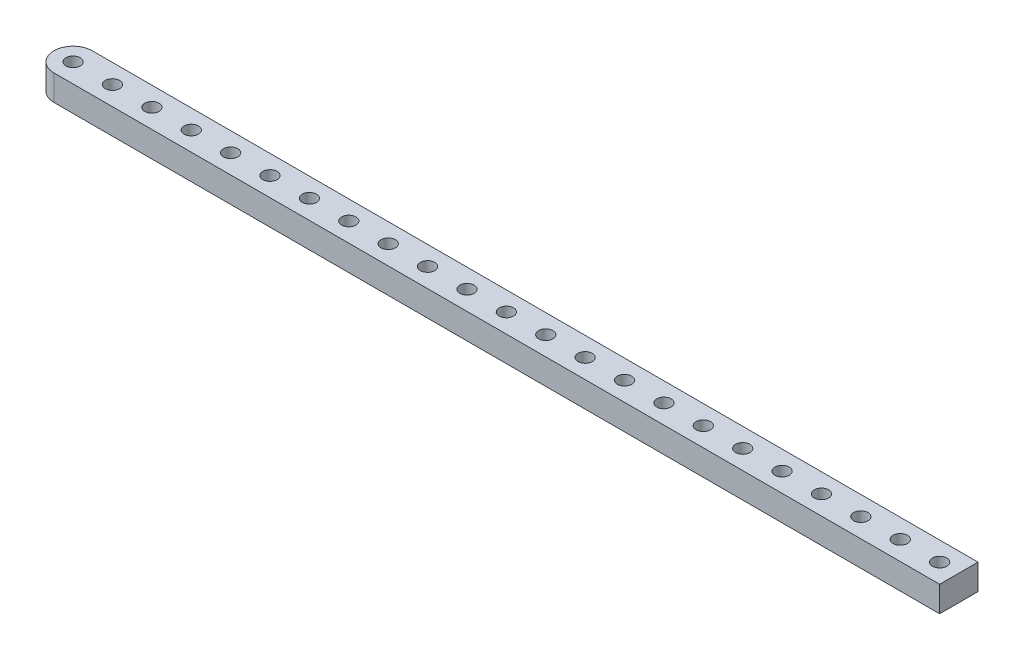
from build123d import *

# Parameters (mm, degrees)
SKETCH1_R           = 1.778
BOSS_EXTRUDE1_DEPTH = 6.35
SKETCH2_W           = 100.128840489
SKETCH2_H           = 9.525
CUT_EXTRUDE1_DEPTH  = 162.421771173


with BuildPart() as part:
    # Sketch1 → Boss-Extrude1 (new body)
    with BuildSketch(Plane(origin=(0, 6.35, 0), x_dir=(1, 0, 0), z_dir=(0, 1, 0))):
        with BuildLine():
            Line((156.464, 4.7625), (-156.464, 4.7625))
            ThreePointArc((-156.464, 4.7625), (-161.2265, 0), (-156.464, -4.7625))
            Line((-156.464, -4.7625), (156.464, -4.7625))
            ThreePointArc((156.464, -4.7625), (161.2265, 0), (156.464, 4.7625))
        make_face()
        with Locations(Location((156.464, 0, 0), (0, 0, 270))):
            Circle(SKETCH1_R, mode=Mode.SUBTRACT)
        with Locations(Location((146.685, 0, 0), (0, 0, 270))):
            Circle(SKETCH1_R, mode=Mode.SUBTRACT)
        with Locations(Location((136.906, 0, 0), (0, 0, 270))):
            Circle(SKETCH1_R, mode=Mode.SUBTRACT)
        with Locations(Location((127.127, 0, 0), (0, 0, 270))):
            Circle(SKETCH1_R, mode=Mode.SUBTRACT)
        with Locations(Location((117.348, 0, 0), (0, 0, 270))):
            Circle(SKETCH1_R, mode=Mode.SUBTRACT)
        with Locations(Location((107.569, 0, 0), (0, 0, 270))):
            Circle(SKETCH1_R, mode=Mode.SUBTRACT)
        with Locations(Location((97.79, 0, 0), (0, 0, 270))):
            Circle(SKETCH1_R, mode=Mode.SUBTRACT)
        with Locations(Location((88.011, 0, 0), (0, 0, 270))):
            Circle(SKETCH1_R, mode=Mode.SUBTRACT)
        with Locations(Location((78.232, 0, 0), (0, 0, 270))):
            Circle(SKETCH1_R, mode=Mode.SUBTRACT)
        with Locations(Location((68.453, 0, 0), (0, 0, 270))):
            Circle(SKETCH1_R, mode=Mode.SUBTRACT)
        with Locations(Location((58.674, 0, 0), (0, 0, 270))):
            Circle(SKETCH1_R, mode=Mode.SUBTRACT)
        with Locations(Location((48.895, 0, 0), (0, 0, 270))):
            Circle(SKETCH1_R, mode=Mode.SUBTRACT)
        with Locations(Location((39.116, 0, 0), (0, 0, 270))):
            Circle(SKETCH1_R, mode=Mode.SUBTRACT)
        with Locations(Location((29.337, 0, 0), (0, 0, 270))):
            Circle(SKETCH1_R, mode=Mode.SUBTRACT)
        with Locations(Location((19.558, 0, 0), (0, 0, 270))):
            Circle(SKETCH1_R, mode=Mode.SUBTRACT)
        with Locations(Location((9.779, 0, 0), (0, 0, 270))):
            Circle(SKETCH1_R, mode=Mode.SUBTRACT)
        with Locations(Location((0, 0, 0), (0, 0, 270))):
            Circle(SKETCH1_R, mode=Mode.SUBTRACT)
        with Locations(Location((-9.779, 0, 0), (0, 0, 270))):
            Circle(SKETCH1_R, mode=Mode.SUBTRACT)
        with Locations(Location((-19.558, 0, 0), (0, 0, 270))):
            Circle(SKETCH1_R, mode=Mode.SUBTRACT)
        with Locations(Location((-29.337, 0, 0), (0, 0, 270))):
            Circle(SKETCH1_R, mode=Mode.SUBTRACT)
        with Locations(Location((-39.116, 0, 0), (0, 0, 270))):
            Circle(SKETCH1_R, mode=Mode.SUBTRACT)
        with Locations(Location((-48.895, 0, 0), (0, 0, 270))):
            Circle(SKETCH1_R, mode=Mode.SUBTRACT)
        with Locations(Location((-58.674, 0, 0), (0, 0, 270))):
            Circle(SKETCH1_R, mode=Mode.SUBTRACT)
        with Locations(Location((-68.453, 0, 0), (0, 0, 270))):
            Circle(SKETCH1_R, mode=Mode.SUBTRACT)
        with Locations(Location((-78.232, 0, 0), (0, 0, 270))):
            Circle(SKETCH1_R, mode=Mode.SUBTRACT)
        with Locations(Location((-88.011, 0, 0), (0, 0, 270))):
            Circle(SKETCH1_R, mode=Mode.SUBTRACT)
        with Locations(Location((-97.79, 0, 0), (0, 0, 270))):
            Circle(SKETCH1_R, mode=Mode.SUBTRACT)
        with Locations(Location((-107.569, 0, 0), (0, 0, 270))):
            Circle(SKETCH1_R, mode=Mode.SUBTRACT)
        with Locations(Location((-117.348, 0, 0), (0, 0, 270))):
            Circle(SKETCH1_R, mode=Mode.SUBTRACT)
        with Locations(Location((-127.127, 0, 0), (0, 0, 270))):
            Circle(SKETCH1_R, mode=Mode.SUBTRACT)
        with Locations(Location((-136.906, 0, 0), (0, 0, 270))):
            Circle(SKETCH1_R, mode=Mode.SUBTRACT)
        with Locations(Location((-146.685, 0, 0), (0, 0, 270))):
            Circle(SKETCH1_R, mode=Mode.SUBTRACT)
        with Locations(Location((-156.464, 0, 0), (0, 0, 270))):
            Circle(SKETCH1_R, mode=Mode.SUBTRACT)
    extrude(amount=-BOSS_EXTRUDE1_DEPTH)

    # Sketch2 → Cut-Extrude1 (cut, through all)
    with BuildSketch(Plane(origin=(0, 6.35, 0), x_dir=(1, 0, 0), z_dir=(0, 1, 0))):
        with Locations((113.500920245, 0)):
            Rectangle(SKETCH2_W, SKETCH2_H)
    extrude(amount=-CUT_EXTRUDE1_DEPTH, mode=Mode.SUBTRACT)


solid = part.part
